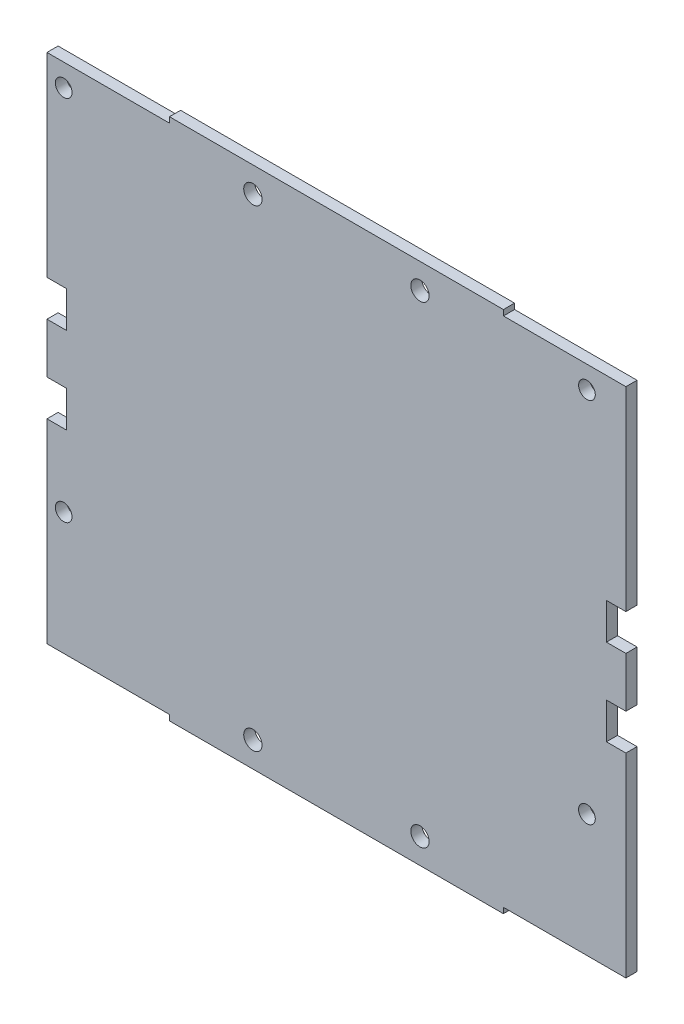
from build123d import *

# Parameters (mm, degrees)
SKETCH1_W                             = 106
SKETCH1_H                             = 95
BOSS_EXTRUDE1_DEPTH                   = 2
SKETCH4_W                             = 128.277926748
SKETCH4_H                             = 110.461548034
SKETCH4_W_2                           = 104
SKETCH4_H_2                           = 94
CUT_EXTRUDE1_DEPTH                    = 10
SKETCH6_W                             = 3.5
SKETCH6_H                             = 6.5
SKETCH6_W_2                           = 22.479668753
SKETCH6_H_2                           = 1.816385789
CUT_EXTRUDE2_DEPTH                    = 5
SKETCH8_R                             = 1.5
CUT_EXTRUDE3_DEPTH                    = 5
TAP_DRILL_FOR_M4X0_7_TAP2_D           = 3.3
TAP_DRILL_FOR_M4X0_7_TAP2_DEPTH       = 10
TAP_DRILL_FOR_M4X0_7_TAP2_CSINK_D     = 3.35
TAP_DRILL_FOR_M4X0_7_TAP2_CSINK_ANGLE = 90
TAP_DRILL_FOR_M4X0_7_TAP2_TIP         = 0.991420021


with BuildPart() as part:
    # Sketch1 → Boss-Extrude1 (new body)
    with BuildSketch(Plane.XY):
        Rectangle(SKETCH1_W, SKETCH1_H)
    extrude(amount=BOSS_EXTRUDE1_DEPTH)

    # Sketch4 → Cut-Extrude1 (cut)
    with BuildSketch(Plane(origin=(0, 0, 0), x_dir=(-1, 0, 0), z_dir=(0, 0, -1))):
        Rectangle(SKETCH4_W, SKETCH4_H)
        Rectangle(SKETCH4_W_2, SKETCH4_H_2, mode=Mode.SUBTRACT)
    extrude(amount=-CUT_EXTRUDE1_DEPTH, mode=Mode.SUBTRACT)

    # Sketch6 → Cut-Extrude2 (cut)
    with BuildSketch(Plane(origin=(0, 0, 0), x_dir=(-1, 0, 0), z_dir=(0, 0, -1))):
        with Locations((-50.25, -7.75)):
            Rectangle(SKETCH6_W, SKETCH6_H)
        with Locations((-50.25, 7.75)):
            Rectangle(SKETCH6_W, SKETCH6_H)
        with Locations((50.25, -7.75)):
            Rectangle(SKETCH6_W, SKETCH6_H)
        with Locations((50.25, 7.75)):
            Rectangle(SKETCH6_W, SKETCH6_H)
        with Locations((-41.239834377, -46.908192895)):
            Rectangle(SKETCH6_W_2, SKETCH6_H_2)
        with Locations((41.239834377, -46.908192895)):
            Rectangle(SKETCH6_W_2, SKETCH6_H_2)
        with Locations((-41.239834377, 46.908192895)):
            Rectangle(SKETCH6_W_2, SKETCH6_H_2)
        with Locations((41.239834377, 46.908192895)):
            Rectangle(SKETCH6_W_2, SKETCH6_H_2)
    extrude(amount=-CUT_EXTRUDE2_DEPTH, mode=Mode.SUBTRACT)

    # Sketch8 → Cut-Extrude3 (cut)
    with BuildSketch(Plane(origin=(0, 0, 0), x_dir=(-1, 0, 0), z_dir=(0, 0, -1))):
        with Locations((-45, 42)):
            Circle(SKETCH8_R)
        with Locations((-45, -24)):
            Circle(SKETCH8_R)
        with Locations((49, 42)):
            Circle(SKETCH8_R)
        with Locations((49, -24)):
            Circle(SKETCH8_R)
    extrude(amount=-CUT_EXTRUDE3_DEPTH, mode=Mode.SUBTRACT)

    # Tap Drill for M4x0.7 Tap2
    with Locations(Plane(origin=(0, 0, 0), x_dir=(-1, 0, 0), z_dir=(0, 0, -1))):
        with Locations((-15.008290978, 42.455982414), (-15.008290978, -42.455982414), (15.008290978, -42.455982414), (15.008290978, 42.455982414)):
            CounterSinkHole(TAP_DRILL_FOR_M4X0_7_TAP2_D / 2, TAP_DRILL_FOR_M4X0_7_TAP2_CSINK_D / 2, depth=TAP_DRILL_FOR_M4X0_7_TAP2_DEPTH, counter_sink_angle=TAP_DRILL_FOR_M4X0_7_TAP2_CSINK_ANGLE)
            with Locations((0, 0, -(TAP_DRILL_FOR_M4X0_7_TAP2_DEPTH + TAP_DRILL_FOR_M4X0_7_TAP2_TIP / 2))):  # 118° drill point
                Cone(0, TAP_DRILL_FOR_M4X0_7_TAP2_D / 2, TAP_DRILL_FOR_M4X0_7_TAP2_TIP, mode=Mode.SUBTRACT)


solid = part.part
